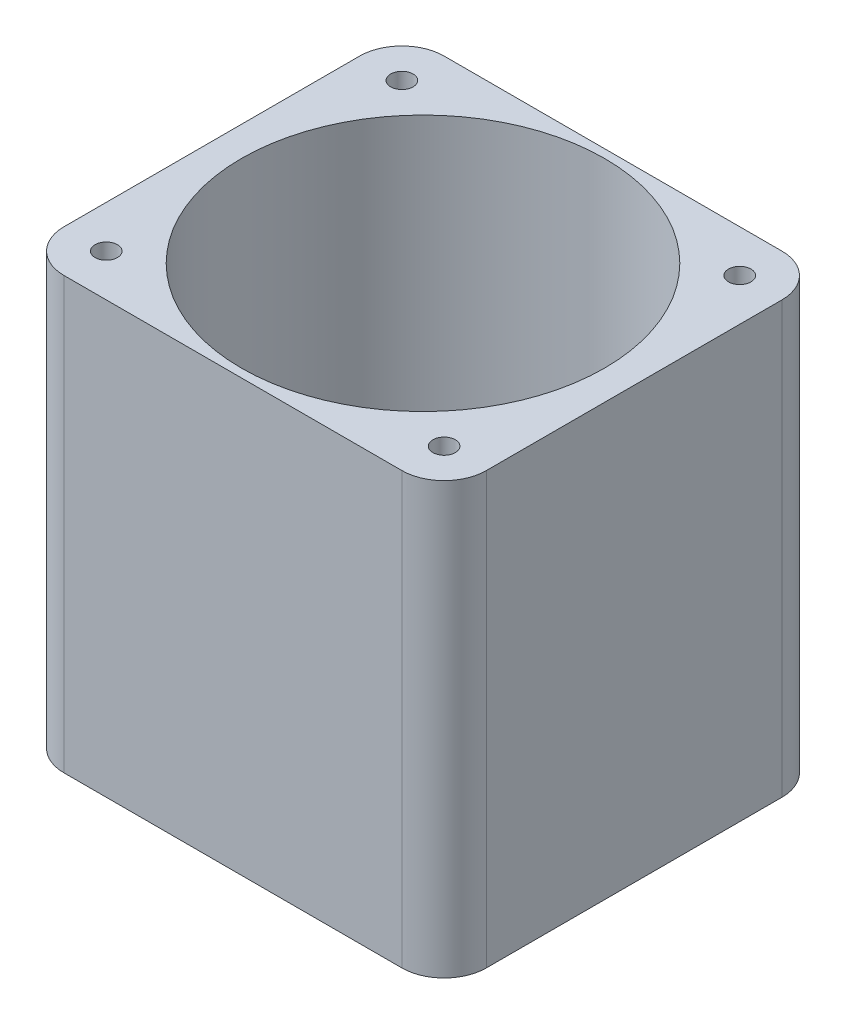
from build123d import *

# Parameters (mm, degrees)
SKETCH_1_R          = 2.65
EXTRUDE_1_DEPTH     = 102
SKETCH_3_R          = 43
CUT_EXTRUDE_1_DEPTH = 123.184287042


with BuildPart() as part:
    # 草图1 → 凸台-拉伸1 (new body)
    with BuildSketch(Plane(origin=(0, 0, 0), x_dir=(1, 0, 0), z_dir=(0, 1, 0))):
        with BuildLine():
            Line((-40, 45), (40, 45))
            ThreePointArc((40, 45), (47.071067812, 42.071067812), (50, 35))
            Line((50, 35), (50, -35))
            ThreePointArc((50, -35), (47.071067812, -42.071067812), (40, -45))
            Line((40, -45), (-40, -45))
            ThreePointArc((-40, -45), (-47.071067812, -42.071067812), (-50, -35))
            Line((-50, -35), (-50, 35))
            ThreePointArc((-50, 35), (-47.071067812, 42.071067812), (-40, 45))
        make_face()
        with Locations(Location((-40, 35, 0), (0, 0, 270))):
            Circle(SKETCH_1_R, mode=Mode.SUBTRACT)
        with Locations(Location((40, 35, 0), (0, 0, 90))):
            Circle(SKETCH_1_R, mode=Mode.SUBTRACT)
        with Locations(Location((40, -35, 0), (0, 0, 270))):
            Circle(SKETCH_1_R, mode=Mode.SUBTRACT)
        with Locations(Location((-40, -35, 0), (0, 0, 90))):
            Circle(SKETCH_1_R, mode=Mode.SUBTRACT)
    extrude(amount=EXTRUDE_1_DEPTH)

    # 草图3 → 切除-拉伸1 (cut, through all)
    with BuildSketch(Plane(origin=(0, 102, 0), x_dir=(1, 0, 0), z_dir=(0, 1, 0))):
        with Locations(Location((0, 0, 0), (0, 0, 270))):
            Circle(SKETCH_3_R)
    extrude(amount=-CUT_EXTRUDE_1_DEPTH, mode=Mode.SUBTRACT)


solid = part.part
